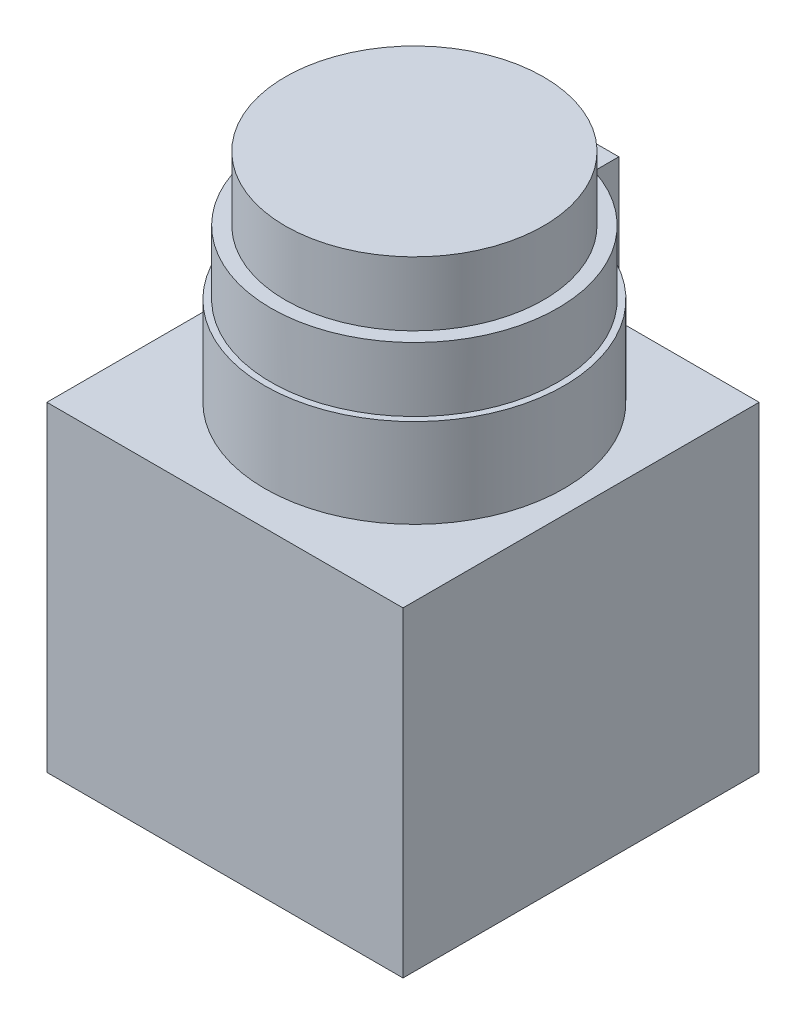
from build123d import *

# Parameters (mm, degrees)
SKETCH1_W        = 50
SKETCH1_H        = 50
EXTRUSION1_DEPTH = 45
SKETCH2_R        = 21
EXTRUSION2_DEPTH = 12.5
SKETCH3_R        = 20.13248881
EXTRUSION3_DEPTH = 9
SKETCH4_R        = 18.13248881
EXTRUSION4_DEPTH = 9
SKETCH5_W        = 9
SKETCH5_H        = 10.2
EXTRUSION5_DEPTH = 20
HOLE1_D          = 2.5
HOLE1_DEPTH      = 8
HOLE1_TIP        = 0.751075774
SKETCH8_W        = 6
SKETCH8_H        = 3
EXTRUSION6_DEPTH = 5
FILLET1_R        = 2


with BuildPart() as part:
    # Sketch1 → Extrusion1 (new body)
    with BuildSketch(Plane(origin=(0, 0, 0), x_dir=(-1, 0, 0), z_dir=(0, 1, 0))):
        with Locations((0.8, 0.8)):
            Rectangle(SKETCH1_W, SKETCH1_H)
    extrude(amount=EXTRUSION1_DEPTH)

    # Sketch2 → Extrusion2 (add)
    with BuildSketch(Plane(origin=(0, 45, 0), x_dir=(-1, 0, 0), z_dir=(0, 1, 0))):
        with Locations(Location((0, 0, 0), (0, 0, 90))):
            Circle(SKETCH2_R)
    extrude(amount=EXTRUSION2_DEPTH)

    # Sketch3 → Extrusion3 (add)
    with BuildSketch(Plane(origin=(0, 57.5, 0), x_dir=(-1, 0, 0), z_dir=(0, 1, 0))):
        with Locations(Location((0, 0, 0), (0, 0, 90))):
            Circle(SKETCH3_R)
    extrude(amount=EXTRUSION3_DEPTH)

    # Sketch4 → Extrusion4 (add)
    with BuildSketch(Plane(origin=(0, 66.5, 0), x_dir=(-1, 0, 0), z_dir=(0, 1, 0))):
        with Locations(Location((0, 0, 0), (0, 0, 90))):
            Circle(SKETCH4_R)
    extrude(amount=EXTRUSION4_DEPTH)

    # Sketch5 → Extrusion5 (add)
    with BuildSketch(Plane(origin=(0, 45, 0), x_dir=(1, 0, 0), z_dir=(0, 1, 0))):
        with Locations((0, 19.1)):
            Rectangle(SKETCH5_W, SKETCH5_H)
    extrude(amount=EXTRUSION5_DEPTH)

    # Hole1
    with Locations(Plane(origin=(0, 0, 0), x_dir=(-1, 0, 0), z_dir=(0, -1, 0))):
        with Locations((-18.420088858, -20.8), (21.579911142, 19.2)):
            Hole(HOLE1_D / 2, depth=HOLE1_DEPTH)
            with Locations((0, 0, -(HOLE1_DEPTH + HOLE1_TIP / 2))):  # 118° drill point
                Cone(0, HOLE1_D / 2, HOLE1_TIP, mode=Mode.SUBTRACT)

    # Sketch8 → Extrusion6 (cut)
    with BuildSketch(Plane.ZY.offset(25.8)):
        with Locations((16.8, 4.5)):
            Rectangle(SKETCH8_W, SKETCH8_H)
    extrude(amount=-EXTRUSION6_DEPTH, mode=Mode.SUBTRACT)

    # Fillet1
    fillet1_edges = [part.edges().sort_by_distance(p)[0] for p in [
        (-23.3, 6, 13.8),
        (-23.3, 6, 19.8),
    ]]
    fillet(fillet1_edges, radius=FILLET1_R)


solid = part.part
